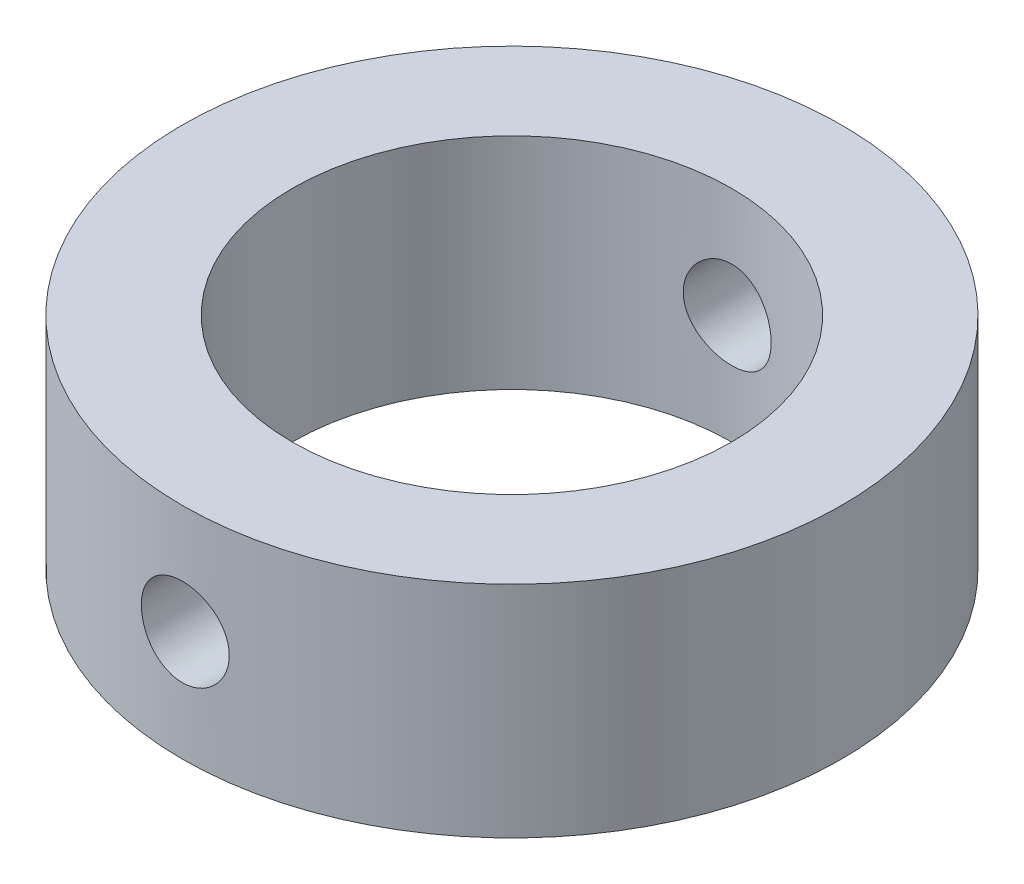
from build123d import *

# Parameters (mm, degrees)
CROQUIS1_R              = 22.5
CROQUIS1_R_2            = 15
SALIENTE_EXTRUIR1_DEPTH = 15
CROQUIS2_R              = 3
CORTAR_EXTRUIR1_DEPTH   = 42.5


with BuildPart() as part:
    # Croquis1 → Saliente-Extruir1 (new body)
    with BuildSketch(Plane(origin=(0, 0, 0), x_dir=(1, 0, 0), z_dir=(0, 1, 0))):
        with Locations(Location((0, 0, 0), (0, 0, 270))):
            Circle(CROQUIS1_R)
        with Locations(Location((0, 0, 0), (0, 0, 270))):
            Circle(CROQUIS1_R_2, mode=Mode.SUBTRACT)
    extrude(amount=SALIENTE_EXTRUIR1_DEPTH)

    # Croquis2 → Cortar-Extruir1 (cut, symmetric)
    with BuildSketch(Plane.XY):
        with Locations((0, 7.5238617)):
            Circle(CROQUIS2_R)
    extrude(amount=CORTAR_EXTRUIR1_DEPTH, both=True, mode=Mode.SUBTRACT)


solid = part.part
